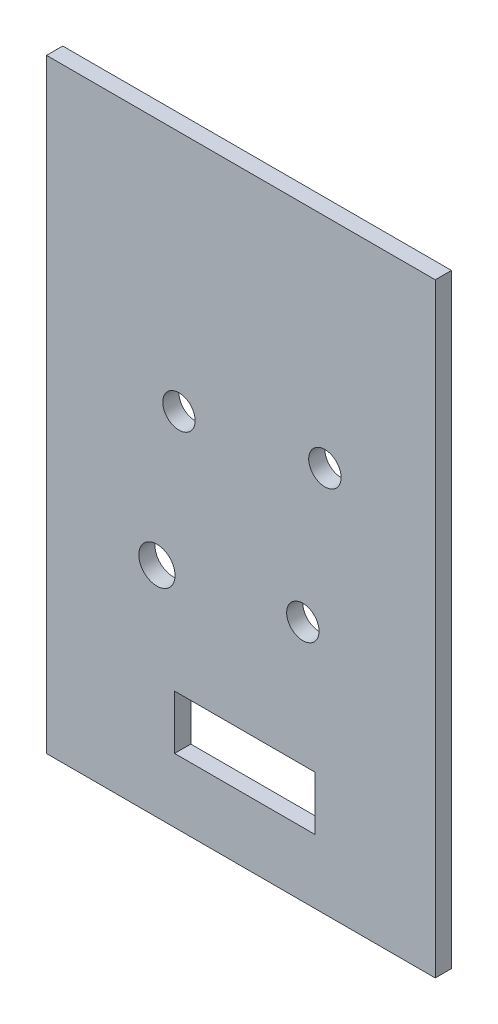
from build123d import *

# Parameters (mm, degrees)
SKETCH1_R           = 1.5
SKETCH1_R_2         = 1.680409227
SKETCH1_W           = 13
SKETCH1_H           = 5
BOSS_EXTRUDE3_DEPTH = 1.5


with BuildPart() as part:
    # Sketch1 → Boss-Extrude3 (new body)
    with BuildSketch(Plane.XY):
        Polygon((-18, 0), (-18, 28), (18, 28), (18, -28), (-18, -28), align=None)
        with Locations((7.778174593, 7.778174593)):
            Circle(SKETCH1_R, mode=Mode.SUBTRACT)
        with Locations((-5.73801436, 5.574512642)):
            Circle(SKETCH1_R, mode=Mode.SUBTRACT)
        with Locations((-7.778174593, -7.778174593)):
            Circle(SKETCH1_R_2, mode=Mode.SUBTRACT)
        with Locations((5.73801436, -5.574512642)):
            Circle(SKETCH1_R, mode=Mode.SUBTRACT)
        with Locations((0.358519309, -19.559341262)):
            Rectangle(SKETCH1_W, SKETCH1_H, mode=Mode.SUBTRACT)
    extrude(amount=BOSS_EXTRUDE3_DEPTH)


solid = part.part
